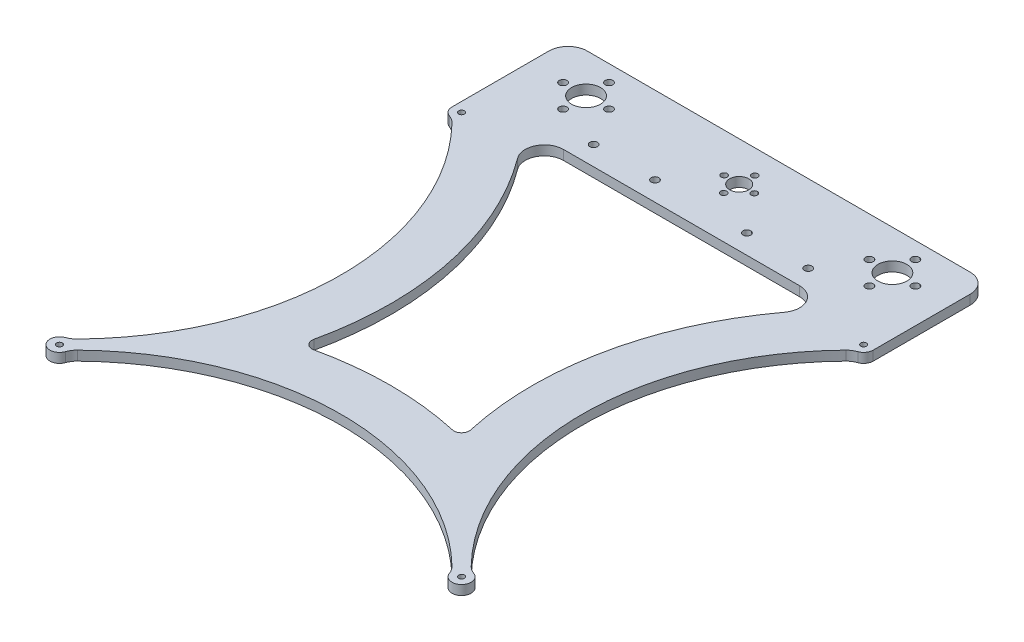
from build123d import *

# Parameters (mm, degrees)
SKETCH1_R           = 1.5
SKETCH1_R_2         = 5
SKETCH1_R_3         = 7.55
SKETCH1_R_4         = 2
SKETCH1_R_5         = 1.625
BOSS_EXTRUDE1_DEPTH = 5


with BuildPart() as part:
    # Sketch1 → Boss-Extrude1 (new body)
    with BuildSketch(Plane.XZ):
        with BuildLine():
            Line((-184.068782704, -199.369837197), (-184.068782704, -249.965787275))
            ThreePointArc((-184.068782704, -249.965787275), (-181.139850516, -257.036855087), (-174.068782704, -259.965787275))
            Line((-174.068782704, -259.965787275), (25.931217296, -259.965787275))
            ThreePointArc((25.931217296, -259.965787275), (33.002285108, -257.036855087), (35.931217296, -249.965787275))
            Line((35.931217296, -249.965787275), (35.931217296, -199.369837197))
            ThreePointArc((35.931217296, -199.369837197), (35.013998456, -196.483507693), (32.598858094, -194.65613651))
            ThreePointArc((32.598858094, -194.65613651), (30.55061758, -193.655934533), (28.782088358, -192.21788113))
            ThreePointArc((28.782088358, -192.21788113), (-11.089192992, -94.369837197), (28.782088358, 3.478206737))
            ThreePointArc((28.782088358, 3.478206737), (30.55061758, 4.916260139), (32.598858094, 5.916462116))
            ThreePointArc((32.598858094, 5.916462116), (34.466751202, 14.165696709), (26.217516609, 12.297803601))
            ThreePointArc((26.217516609, 12.297803601), (25.217314632, 10.249563087), (23.77926123, 8.481033865))
            ThreePointArc((23.77926123, 8.481033865), (-74.068782704, -31.390247486), (-171.916826637, 8.481033865))
            ThreePointArc((-171.916826637, 8.481033865), (-173.35488004, 10.249563087), (-174.355082017, 12.297803601))
            ThreePointArc((-174.355082017, 12.297803601), (-182.60431661, 14.165696709), (-180.736423502, 5.916462116))
            ThreePointArc((-180.736423502, 5.916462116), (-178.688182988, 4.916260139), (-176.919653766, 3.478206737))
            ThreePointArc((-176.919653766, 3.478206737), (-137.048372415, -94.369837197), (-176.919653766, -192.21788113))
            ThreePointArc((-176.919653766, -192.21788113), (-178.688182988, -193.655934533), (-180.736423502, -194.65613651))
            ThreePointArc((-180.736423502, -194.65613651), (-183.151563863, -196.483507693), (-184.068782704, -199.369837197))
        make_face()
        with Locations(Location((-179.068782704, -199.369837197, 0), (0, 0, 90))):
            Circle(SKETCH1_R, mode=Mode.SUBTRACT)
        with Locations(Location((-179.068782704, 10.630162803, 0), (0, 0, 90))):
            Circle(SKETCH1_R, mode=Mode.SUBTRACT)
        with Locations(Location((30.931217296, 10.630162803, 0), (0, 0, 90))):
            Circle(SKETCH1_R, mode=Mode.SUBTRACT)
        with Locations(Location((30.931217296, -199.369837197, 0), (0, 0, 90))):
            Circle(SKETCH1_R, mode=Mode.SUBTRACT)
        with Locations(Location((-74.068782704, -239.369837197, 0), (0, 0, 90))):
            Circle(SKETCH1_R_2, mode=Mode.SUBTRACT)
        with Locations(Location((5.931217296, -239.369837197, 0), (0, 0, 90))):
            Circle(SKETCH1_R_3, mode=Mode.SUBTRACT)
        with Locations(Location((-154.068782704, -239.369837197, 0), (0, 0, 90))):
            Circle(SKETCH1_R_3, mode=Mode.SUBTRACT)
        with Locations(Location((-154.068782704, -251.369837197, 0), (0, 0, 90))):
            Circle(SKETCH1_R_4, mode=Mode.SUBTRACT)
        with Locations(Location((-142.068782704, -239.369837197, 0), (0, 0, 90))):
            Circle(SKETCH1_R_4, mode=Mode.SUBTRACT)
        with Locations(Location((-154.068782704, -227.369837197, 0), (0, 0, 90))):
            Circle(SKETCH1_R_4, mode=Mode.SUBTRACT)
        with Locations(Location((-166.068782704, -239.369837197, 0), (0, 0, 90))):
            Circle(SKETCH1_R_4, mode=Mode.SUBTRACT)
        with Locations(Location((5.931217296, -251.369837197, 0), (0, 0, 90))):
            Circle(SKETCH1_R_4, mode=Mode.SUBTRACT)
        with Locations(Location((-6.068782704, -239.369837197, 0), (0, 0, 90))):
            Circle(SKETCH1_R_4, mode=Mode.SUBTRACT)
        with Locations(Location((5.931217296, -227.369837197, 0), (0, 0, 90))):
            Circle(SKETCH1_R_4, mode=Mode.SUBTRACT)
        with Locations(Location((17.931217296, -239.369837197, 0), (0, 0, 90))):
            Circle(SKETCH1_R_4, mode=Mode.SUBTRACT)
        with Locations(Location((-73.929921751, -247.368631958, 0), (0, 0, 90))):
            Circle(SKETCH1_R_5, mode=Mode.SUBTRACT)
        with Locations(Location((-66.069987942, -239.230976244, 0), (0, 0, 90))):
            Circle(SKETCH1_R_5, mode=Mode.SUBTRACT)
        with Locations(Location((-74.207643657, -231.371042435, 0), (0, 0, 90))):
            Circle(SKETCH1_R_5, mode=Mode.SUBTRACT)
        with Locations(Location((-82.067577465, -239.50869815, 0), (0, 0, 90))):
            Circle(SKETCH1_R_5, mode=Mode.SUBTRACT)
        with Locations(Location((-130.068782704, -219.369837197, 0), (0, 0, 90))):
            Circle(SKETCH1_R_4, mode=Mode.SUBTRACT)
        with Locations(Location((-98.068782704, -219.369837197, 0), (0, 0, 90))):
            Circle(SKETCH1_R_4, mode=Mode.SUBTRACT)
        with Locations(Location((-18.068782704, -219.369837197, 0), (0, 0, 90))):
            Circle(SKETCH1_R_4, mode=Mode.SUBTRACT)
        with Locations(Location((-50.068782704, -219.369837197, 0), (0, 0, 90))):
            Circle(SKETCH1_R_4, mode=Mode.SUBTRACT)
        with BuildLine():
            Line((-135.716591192, -209.257050985), (-12.420974216, -209.257050985))
            ThreePointArc((-12.420974216, -209.257050985), (-3.488029353, -203.751769673), (-4.390759374, -193.297550202))
            ThreePointArc((-4.390759374, -193.297550202), (-33.466178067, -128.862078617), (-33.094357447, -58.171402287))
            ThreePointArc((-33.094357447, -58.171402287), (-34.169669225, -54.470723718), (-37.870347793, -53.39541194))
            ThreePointArc((-37.870347793, -53.39541194), (-74.068782704, -57.390247486), (-110.267217614, -53.39541194))
            ThreePointArc((-110.267217614, -53.39541194), (-113.967896183, -54.470723718), (-115.04320796, -58.171402287))
            ThreePointArc((-115.04320796, -58.171402287), (-114.671387341, -128.862078617), (-143.746806034, -193.297550202))
            ThreePointArc((-143.746806034, -193.297550202), (-144.649536054, -203.751769673), (-135.716591192, -209.257050985))
        make_face(mode=Mode.SUBTRACT)
    extrude(amount=-BOSS_EXTRUDE1_DEPTH)


solid = part.part
